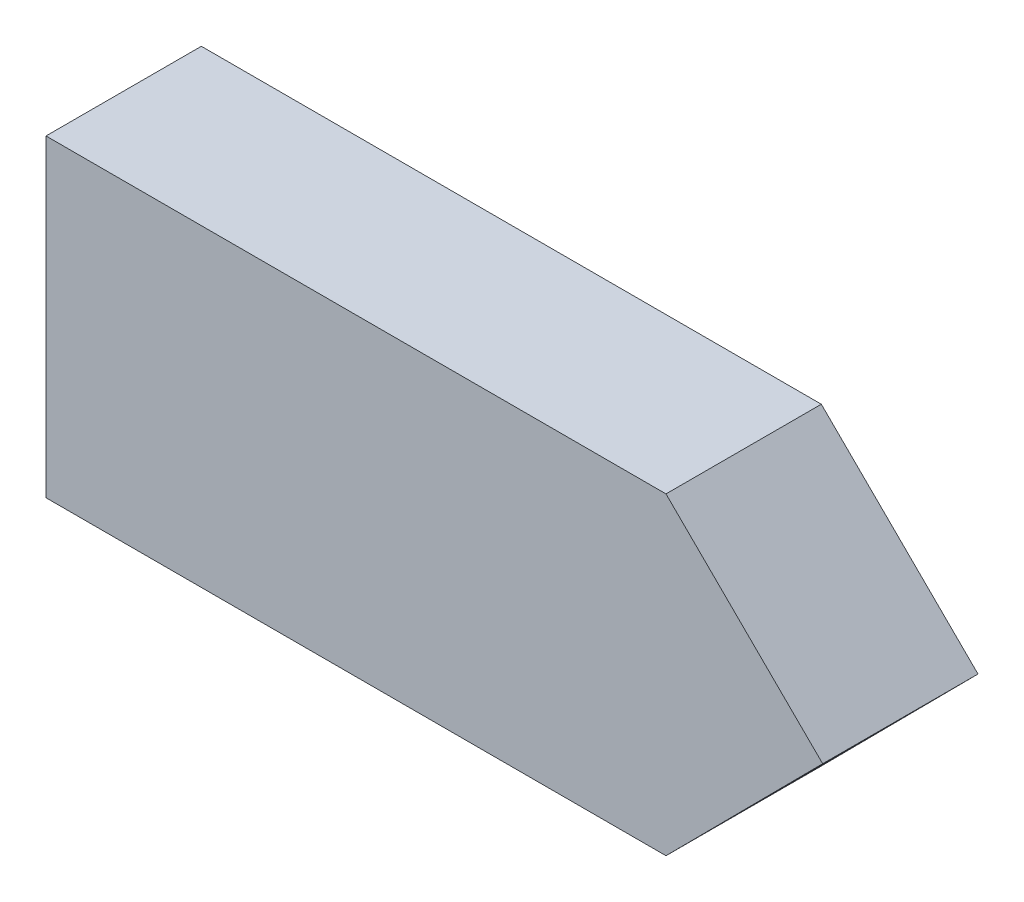
from build123d import *

# Parameters (mm, degrees)
BOSS_EXTRUDE1_DEPTH = 10


with BuildPart() as part:
    # Sketch1 → Boss-Extrude1 (new body)
    with BuildSketch(Plane.XY):
        Polygon((-60, 40), (-20.086416767, 40), (-10, 30), (-20.086416767, 19.826419679), (-60, 19.826419679), align=None)
    extrude(amount=BOSS_EXTRUDE1_DEPTH)


solid = part.part
